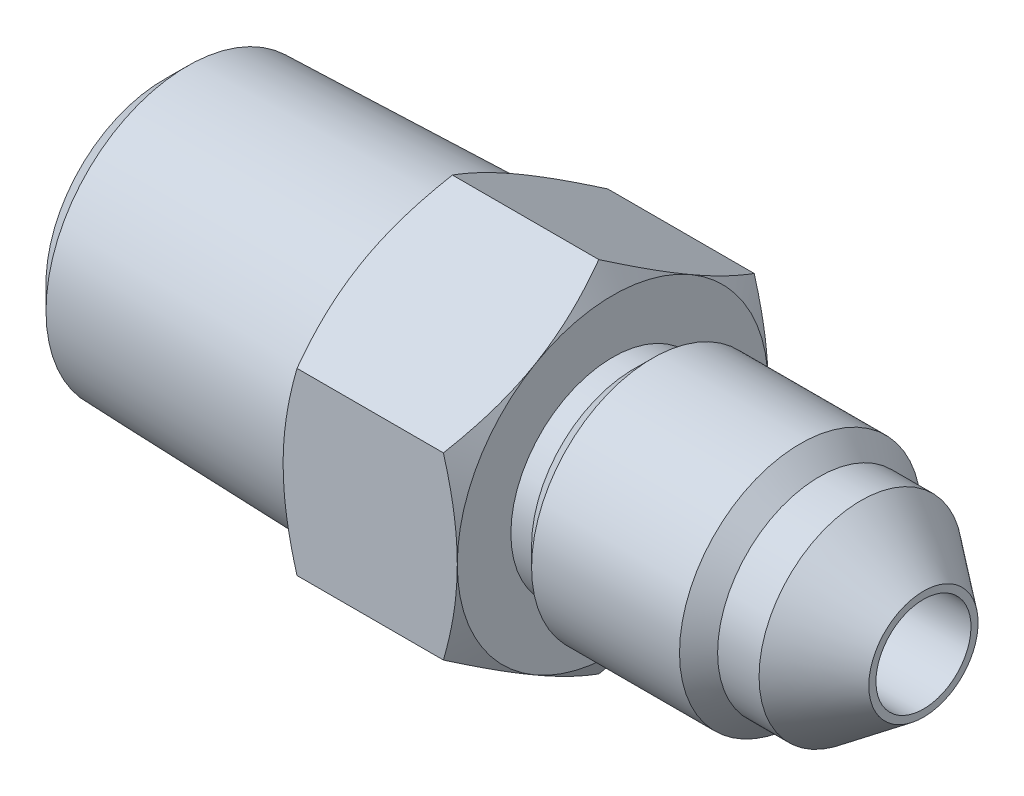
from build123d import *

# Parameters (mm, degrees)
SKETCH6_W           = 34.925
SKETCH6_H           = 5.55625
EXTRUDE1_DEPTH      = 8.00608
SKETCH7_W           = 34.925
SKETCH7_H           = 2.1844
SKETCH17_R          = 5.55625
CUT_EXTRUDE1_DEPTH  = 12.63142
SKETCH19_R          = 6.858
BOSS_EXTRUDE1_DEPTH = 12.63142
BOSS_EXTRUDE1_DRAFT = -1.75
CHAMFER1_SIZE       = 1.058333333
CHAMFER1_SIZE2      = 1.092196811
SKETCH22_R          = 6.858
BOSS_EXTRUDE3_DEPTH = 12.63142
BOSS_EXTRUDE3_DRAFT = -15
SKETCH23_R          = 4.651741881
CUT_EXTRUDE2_DEPTH  = 12.63142


with BuildPart() as part:
    # Sketch6 → Revolve3 (revolve)
    with BuildSketch(Plane.XY, mode=Mode.PRIVATE) as revolve3_sk:
        with Locations((0, 2.778125)):
            Rectangle(SKETCH6_W, SKETCH6_H)
    revolve(revolve3_sk.sketch.rotate(Axis((-17.4625, 0, 0), (1, 0, 0)), 90), axis=Axis((-17.4625, 0, 0), (1, 0, 0)))

    # Sketch12 → Extrude1 (add)
    with BuildSketch(Plane(origin=(-4.83108, 0, 0), x_dir=(0, 0, -1), z_dir=(1, 0, 0))):
        Polygon((0, 8.248891971), (-7.14375, 4.124445986), (-7.14375, -4.124445986), (0, -8.248891971), (7.14375, -4.124445986), (7.14375, 4.124445986), align=None)
    extrude(amount=EXTRUDE1_DEPTH)

    # Sketch10 → Cut-Revolve6 (revolve, cut)
    with BuildSketch(Plane.XY, mode=Mode.PRIVATE) as cut_revolve6_sk:
        Polygon((5.003189197, 5.55625), (3.175, 5.55625), (3.175, 4.680560803), (4.1275, 4.680560803), align=None)
        Polygon((17.4625, 5.55625), (11.804113042, 5.55625), (12.679802239, 4.680560803), (14.584802239, 4.680560803), (17.4625, 2.51206), align=None)
    revolve(cut_revolve6_sk.sketch.rotate(Axis((-17.4625, 0, 0), (1, 0, 0)), 90), axis=Axis((-17.4625, 0, 0), (1, 0, 0)), mode=Mode.SUBTRACT)

    # Sketch7 → Cut-Revolve5 (revolve, cut)
    with BuildSketch(Plane.XY):
        with Locations((0, 1.0922)):
            Rectangle(SKETCH7_W, SKETCH7_H)
    revolve(axis=Axis((17.4625, 0, 0), (-1, 0, 0)), mode=Mode.SUBTRACT)

    # Sketch13 → Cut-Revolve7 (revolve, cut)
    with BuildSketch(Plane.XY):
        Polygon((-4.83108, 8.248891971), (-4.83108, 7.14375), (-4.193025986, 8.248891971), align=None)
        Polygon((2.536945986, 8.248891971), (3.175, 7.14375), (3.175, 8.248891971), align=None)
    revolve(axis=Axis((-17.4625, 0, 0), (1, 0, 0)), mode=Mode.SUBTRACT)

    # Sketch17 → Cut-Extrude1 (cut)
    with BuildSketch(Plane.ZY.offset(17.4625)):
        Circle(SKETCH17_R)
    extrude(amount=-CUT_EXTRUDE1_DEPTH, mode=Mode.SUBTRACT)


with BuildPart() as body_2:
    # Sketch19 → Boss-Extrude1 (with draft: the straight prism first)
    with BuildSketch(Plane(origin=(-4.83108, 0, 0), x_dir=(0, 0, -1), z_dir=(1, 0, 0))):
        Circle(SKETCH19_R)
    extrude(amount=-BOSS_EXTRUDE1_DEPTH)
    # Boss-Extrude1: the draft: its side faces are tilted about the plane it starts from
    boss_extrude1_sides = [body_2.faces().sort_by_distance(p)[0] for p in [
        (-11.14679, 0, 6.858),
    ]]
    draft(boss_extrude1_sides, Plane(origin=(-4.83108, 0, 0), x_dir=(0, 0, -1), z_dir=(1, 0, 0)), BOSS_EXTRUDE1_DRAFT)

    # Chamfer1
    chamfer1_edges = [body_2.edges().sort_by_distance(p)[0] for p in [
        (-17.4625, 0, 6.472075215),
    ]]
    chamfer1_side = [body_2.faces().sort_by_distance(p)[0] for p in [
        (-17.4625, 0, 0),
    ]]
    chamfer(chamfer1_edges, length=CHAMFER1_SIZE, length2=CHAMFER1_SIZE2, reference=chamfer1_side[0])


with BuildPart() as boss_extrude3_tool:
    # Sketch22 → Boss-Extrude3 (with draft: the straight prism first)
    with BuildSketch(Plane(origin=(-4.83108, 0, 0), x_dir=(0, 0, -1), z_dir=(1, 0, 0))):
        Circle(SKETCH22_R)
    extrude(amount=-BOSS_EXTRUDE3_DEPTH)
    # Boss-Extrude3: the draft: its side faces are tilted about the plane it starts from
    boss_extrude3_sides = [boss_extrude3_tool.faces().sort_by_distance(p)[0] for p in [
        (-11.14679, 0, 6.858),
    ]]
    draft(boss_extrude3_sides, Plane(origin=(-4.83108, 0, 0), x_dir=(0, 0, -1), z_dir=(1, 0, 0)), BOSS_EXTRUDE3_DRAFT)


with BuildPart() as body_2_1:
    add(body_2.part)

    # Boss-Extrude3: add boss_extrude3_tool
    add(boss_extrude3_tool.part)

    # Combine1: union part
    add(part.part)

    # Sketch23 → Cut-Extrude2 (cut)
    with BuildSketch(Plane.ZY.offset(17.4625)):
        Circle(SKETCH23_R)
    extrude(amount=-CUT_EXTRUDE2_DEPTH, mode=Mode.SUBTRACT)


solid = body_2_1.part
